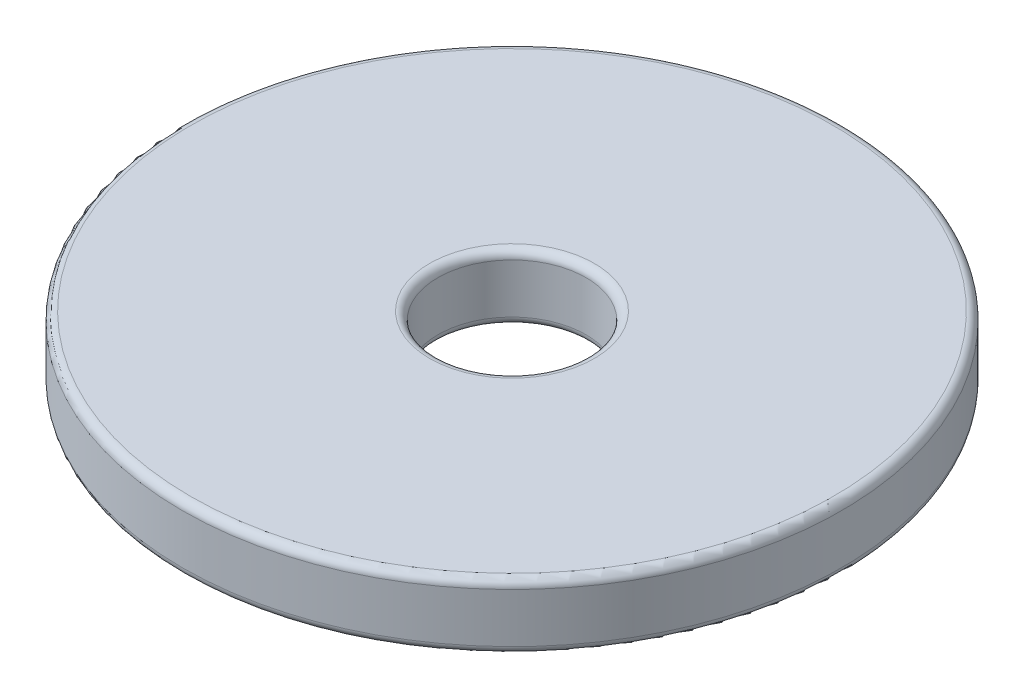
from build123d import *

# Parameters (mm, degrees)
SKETCH1_R           = 10
SKETCH1_R_2         = 2.25
BOSS_EXTRUDE1_DEPTH = 2
FILLET1_R           = 0.25


with BuildPart() as part:
    # Sketch1 → Boss-Extrude1 (new body)
    with BuildSketch(Plane(origin=(0, 0, 0), x_dir=(1, 0, 0), z_dir=(0, 1, 0))):
        with Locations(Location((0, 0, 0), (0, 0, 270))):
            Circle(SKETCH1_R)
        with Locations(Location((0, 0, 0), (0, 0, 270))):
            Circle(SKETCH1_R_2, mode=Mode.SUBTRACT)
    extrude(amount=BOSS_EXTRUDE1_DEPTH)

    # Fillet1
    fillet1_edges = [part.edges().sort_by_distance(p)[0] for p in [
        (0, 0, -10),
        (0, 2, -10),
        (0, 0, -2.25),
        (0, 2, -2.25),
    ]]
    fillet(fillet1_edges, radius=FILLET1_R)


solid = part.part
